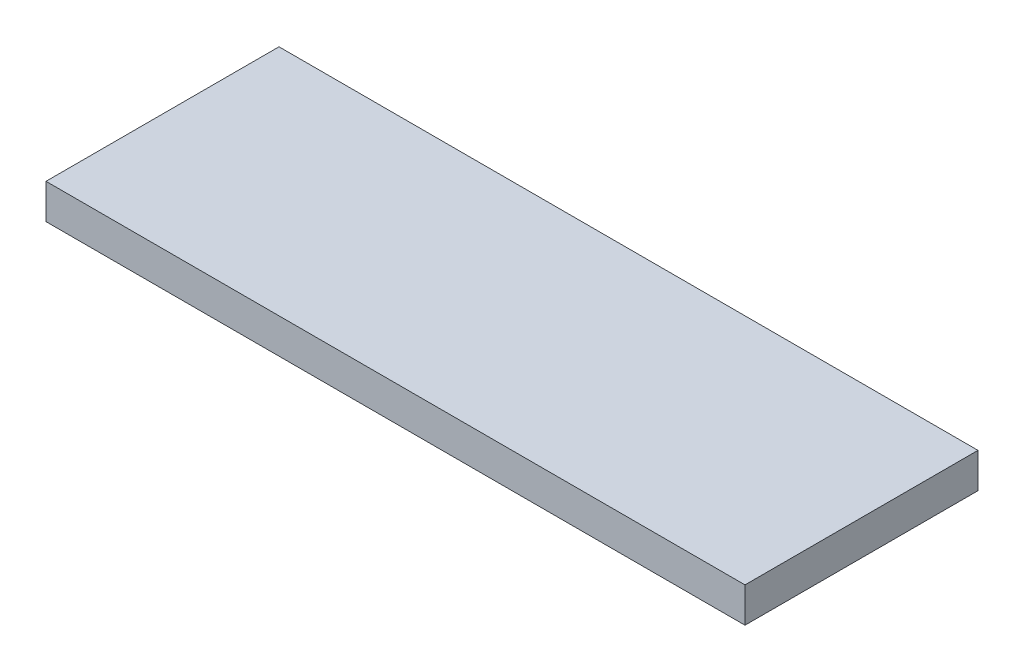
from build123d import *

# Parameters (mm, degrees)
SKETCH1_W           = 60
SKETCH1_H           = 20
BOSS_EXTRUDE1_DEPTH = 3


with BuildPart() as part:
    # Sketch1 → Boss-Extrude1 (new body)
    with BuildSketch(Plane(origin=(0, 0, 0), x_dir=(1, 0, 0), z_dir=(0, 1, 0))):
        Rectangle(SKETCH1_W, SKETCH1_H)
    extrude(amount=BOSS_EXTRUDE1_DEPTH)


solid = part.part
